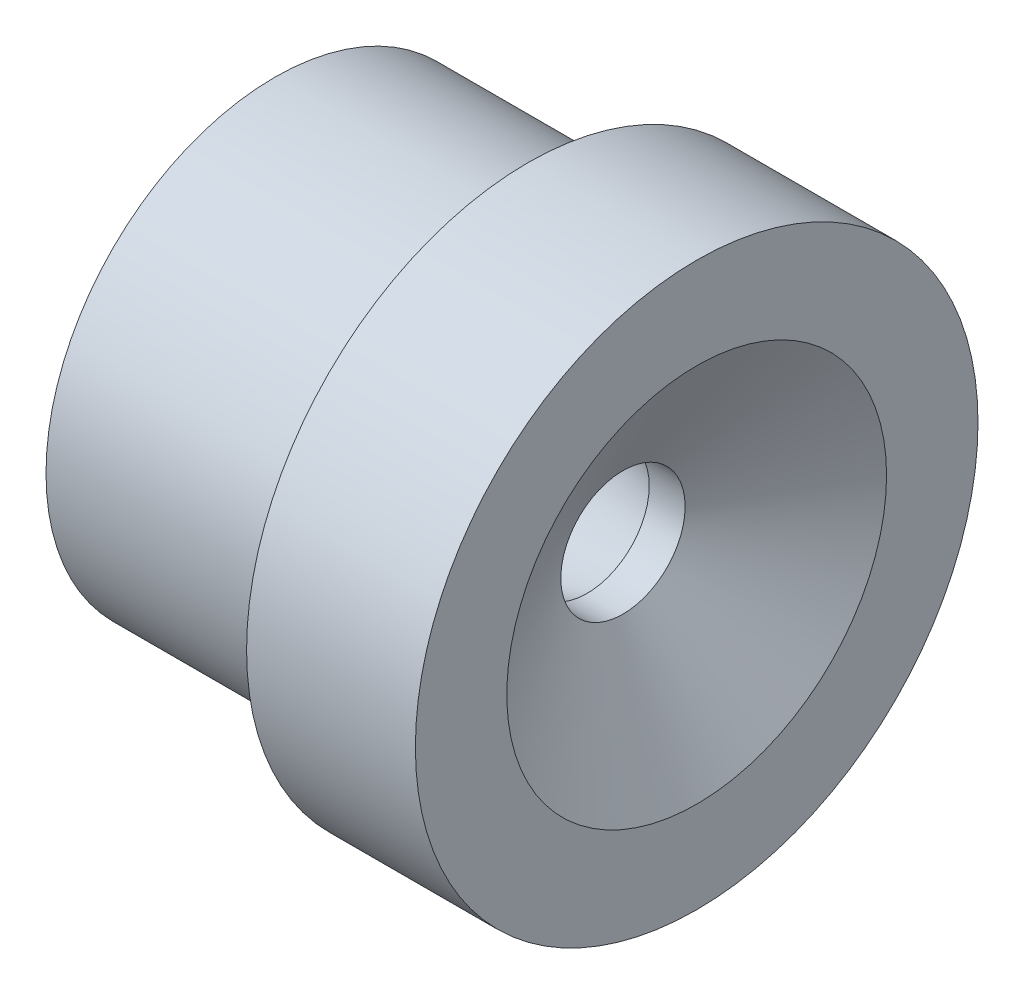
from build123d import *


with BuildPart() as part:
    # Sketch1 → Revolve1 (revolve)
    with BuildSketch(Plane(origin=(0, 0, 0), x_dir=(1, 0, 0), z_dir=(0, 1, 0)), mode=Mode.PRIVATE) as revolve1_sk:
        Polygon((0, 0), (0, 4.1275), (-3.328886182, 9.8933), (-4.949406182, 9.8933), (-19.05, 6.115057274), (-19.05, 2.3749), (-7.62, 2.3749), (-7.62, 0), align=None)
    revolve(revolve1_sk.sketch.rotate(Axis((5.118729701, 0, -12.7), (-1, 0, 0)), 180), axis=Axis((5.118729701, 0, -12.7), (-1, 0, 0)))


solid = part.part
